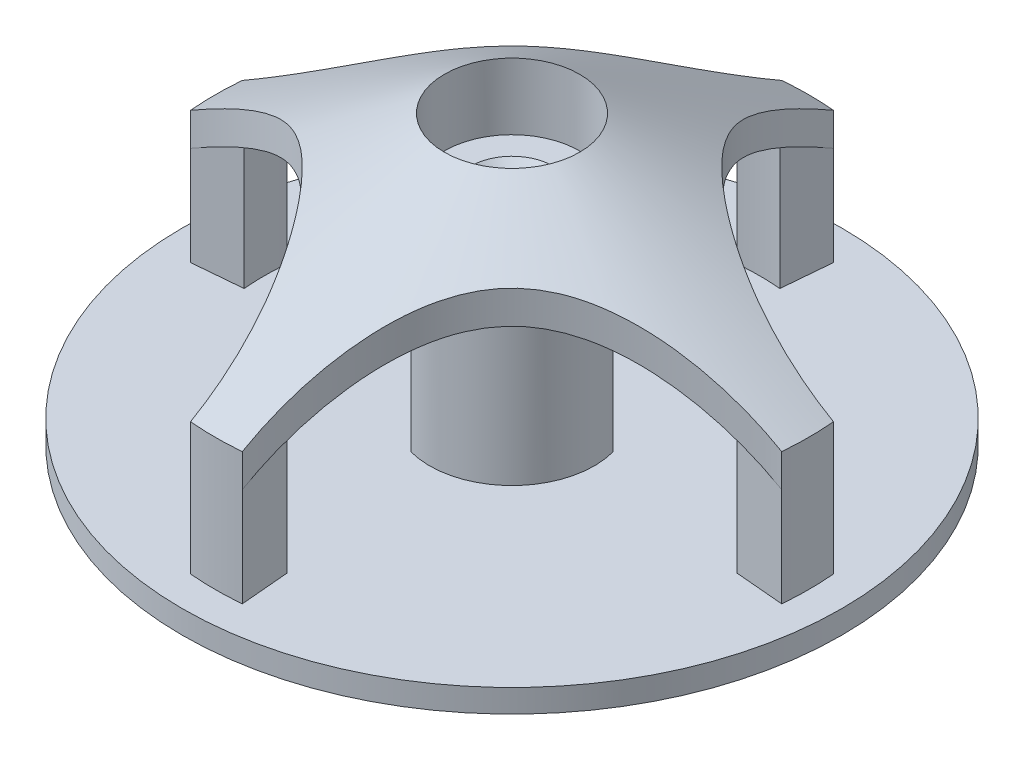
from build123d import *

# Parameters (mm, degrees)
SKETCH1_R                      = 127
BASE_OF_BASE_DEPTH             = 8.89
BALL_BEARING_CUT_REACH         = 221.212
SKETCH8_R                      = 26.035
SUPPORT_REACH                  = 208.429
SUPPORTS_COUNT                 = 4
CUT_FOR_PRINTABIITY_REACH      = 221.212
HOLDER_START                   = 76.2
SKETCH14_R                     = 26.035
SKETCH14_R_2                   = 13.335
HOLDER_FOR_SHOULDER_DEPTH      = 76.2
CENTER_CYLINDER_REACH          = 208.429
SKETCH14_3_R                   = 31.75
SKETCH14_3_R_2                 = 26.035
FUNNEL_INTO_SNAP_IN_PLACE_SIZE = 2.54
ACCESSIBILITY_CUT_DEPTH        = 290.1712073


with BuildPart() as part:
    # Sketch1 → Base of base (new body)
    with BuildSketch(Plane(origin=(0, 0, 0), x_dir=(1, 0, 0), z_dir=(0, 1, 0))):
        with Locations(Location((0, 0, 0), (0, 0, 270))):
            Circle(SKETCH1_R)
    extrude(amount=BASE_OF_BASE_DEPTH)



with BuildPart() as body_2:
    # Sketch7 → Top Part of Base (revolve)
    with BuildSketch(Plane(origin=(0, 0, 0), x_dir=(0, 0, -1), z_dir=(1, 0, 0)), mode=Mode.PRIVATE) as top_part_of_base_sk:
        Polygon((0, 125.681135768), (0, 112.981135768), (-114.3, 46.99), (-114.3, 59.69), align=None)
    revolve(top_part_of_base_sk.sketch.rotate(Axis((0, 8.89, 0), (0, 1, 0)), 180), axis=Axis((0, 8.89, 0), (0, 1, 0)))

    # Ball Bearing Cut: up to this cone (the profile starts outside it)
    ball_bearing_cut_end = Plane(origin=(0, 125.681136, 0), z_dir=(0, -1, 0)).offset(12.700001232) * Cone(1.732e-06, 362.01940299, 209.011998768, align=(Align.CENTER, Align.CENTER, Align.MIN), mode=Mode.PRIVATE)
    # Sketch8 → Ball Bearing Cut (cut, up to the surface)
    with BuildSketch(Plane(origin=(0, 125.681135768, 0), x_dir=(1, 0, 0), z_dir=(0, 1, 0)), mode=Mode.PRIVATE) as ball_bearing_cut_sk1:
        with Locations(Location((0, 0, 0), (0, 0, 90))):
            Circle(SKETCH8_R)
    ball_bearing_cut_tool1 = extrude(ball_bearing_cut_sk1.sketch, amount=-BALL_BEARING_CUT_REACH, mode=Mode.PRIVATE) - ball_bearing_cut_end
    add(ball_bearing_cut_tool1.solids().sort_by_distance((0, 125.681136, 0))[0], mode=Mode.SUBTRACT)


with BuildPart() as part_1:
    add(part.part)

    add(body_2.part)  # Support merges body 2
    # Support: up to this cone (the profile starts inside it)
    support_end = Plane(origin=(0, 8.89, 0), z_dir=(0, -1, 0)).offset(-104.091134768) * Cone(1.732e-06, 854.440186248, 493.311270537, align=(Align.CENTER, Align.CENTER, Align.MIN), mode=Mode.PRIVATE)
    # Sketch10 → Support (add, up to the surface)
    with BuildSketch(Plane(origin=(0, 8.89, 0), x_dir=(1, 0, 0), z_dir=(0, 1, 0)), mode=Mode.PRIVATE) as support_sk1:
        with BuildLine():
            ThreePointArc((-8.301584497, 94.887544993), (-4.154746647, 95.159343106), (0, 95.25))
            Line((0, 95.25), (0, 114.3))
            ThreePointArc((0, 114.3), (-4.985695976, 114.191211727), (-9.961901396, 113.865053992))
            Line((-9.961901396, 113.865053992), (-8.301584497, 94.887544993))
        make_face()
    support_tool1 = extrude(support_sk1.sketch, amount=SUPPORT_REACH, mode=Mode.PRIVATE) & support_end
    # Sketch10 → Support (add, up to the surface)
    with BuildSketch(Plane(origin=(0, 8.89, 0), x_dir=(1, 0, 0), z_dir=(0, 1, 0)), mode=Mode.PRIVATE) as support_sk2:
        with BuildLine():
            Line((0, 114.3), (0, 95.25))
            ThreePointArc((0, 95.25), (4.154746647, 95.159343106), (8.301584497, 94.887544993))
            Line((8.301584497, 94.887544993), (9.961901396, 113.865053992))
            ThreePointArc((9.961901396, 113.865053992), (4.985695976, 114.191211727), (0, 114.3))
        make_face()
    support_tool2 = extrude(support_sk2.sketch, amount=SUPPORT_REACH, mode=Mode.PRIVATE) & support_end
    support = support_tool1.solids().sort_by_distance((-4.581357, 8.89, -104.930336))[0] + support_tool2.solids().sort_by_distance((4.581357, 8.89, -104.930336))[0]
    add(support)

    # Supports: Support ×4 about axis
    supports_axis = Axis((0, 8.89, 0), (0, 1, 0))
    for i in range(1, SUPPORTS_COUNT):
        add(support.rotate(supports_axis, i * 360 / SUPPORTS_COUNT))

    # Cut for Printabiity: up to this cone (the profile starts outside it)
    cut_for_printabiity_end = Plane(origin=(0, 125.681136, 0), z_dir=(0, -1, 0)).offset(12.700001232) * Cone(1.732e-06, 362.01940299, 209.011998768, align=(Align.CENTER, Align.CENTER, Align.MIN), mode=Mode.PRIVATE)
    # Sketch12 → Cut for Printabiity (cut, up to the surface)
    with BuildSketch(Plane(origin=(0, 125.681135768, 0), x_dir=(1, 0, 0), z_dir=(0, 1, 0)), mode=Mode.PRIVATE) as cut_for_printabiity_sk1:
        with BuildLine():
            ThreePointArc((-113.865053992, -9.961901396), (-40.394430205, -40.394430205), (-9.961901396, -113.865053992))
            ThreePointArc((-9.961901396, -113.865053992), (-80.82230509, -80.82230509), (-113.865053992, -9.961901396))
        make_face()
    cut_for_printabiity_tool1 = extrude(cut_for_printabiity_sk1.sketch, amount=-CUT_FOR_PRINTABIITY_REACH, mode=Mode.PRIVATE) - cut_for_printabiity_end
    add(cut_for_printabiity_tool1.solids().sort_by_distance((-60.814886, 125.681136, 60.814886))[0], mode=Mode.SUBTRACT)
    # Sketch12 → Cut for Printabiity (cut, up to the surface)
    with BuildSketch(Plane(origin=(0, 125.681135768, 0), x_dir=(1, 0, 0), z_dir=(0, 1, 0)), mode=Mode.PRIVATE) as cut_for_printabiity_sk2:
        with BuildLine():
            ThreePointArc((-9.961901396, 113.865053992), (-40.394430205, 40.394430205), (-113.865053992, 9.961901396))
            ThreePointArc((-113.865053992, 9.961901396), (-80.82230509, 80.82230509), (-9.961901396, 113.865053992))
        make_face()
    cut_for_printabiity_tool2 = extrude(cut_for_printabiity_sk2.sketch, amount=-CUT_FOR_PRINTABIITY_REACH, mode=Mode.PRIVATE) - cut_for_printabiity_end
    add(cut_for_printabiity_tool2.solids().sort_by_distance((-60.814886, 125.681136, -60.814886))[0], mode=Mode.SUBTRACT)
    # Sketch12 → Cut for Printabiity (cut, up to the surface)
    with BuildSketch(Plane(origin=(0, 125.681135768, 0), x_dir=(1, 0, 0), z_dir=(0, 1, 0)), mode=Mode.PRIVATE) as cut_for_printabiity_sk3:
        with BuildLine():
            ThreePointArc((9.961901396, 113.865053992), (40.394430205, 40.394430205), (113.865053992, 9.961901396))
            ThreePointArc((113.865053992, 9.961901396), (80.82230509, 80.82230509), (9.961901396, 113.865053992))
        make_face()
    cut_for_printabiity_tool3 = extrude(cut_for_printabiity_sk3.sketch, amount=-CUT_FOR_PRINTABIITY_REACH, mode=Mode.PRIVATE) - cut_for_printabiity_end
    add(cut_for_printabiity_tool3.solids().sort_by_distance((60.814886, 125.681136, -60.814886))[0], mode=Mode.SUBTRACT)
    # Sketch12 → Cut for Printabiity (cut, up to the surface)
    with BuildSketch(Plane(origin=(0, 125.681135768, 0), x_dir=(1, 0, 0), z_dir=(0, 1, 0)), mode=Mode.PRIVATE) as cut_for_printabiity_sk4:
        with BuildLine():
            ThreePointArc((9.961901396, -113.865053992), (40.394430205, -40.394430205), (113.865053992, -9.961901396))
            ThreePointArc((113.865053992, -9.961901396), (80.82230509, -80.82230509), (9.961901396, -113.865053992))
        make_face()
    cut_for_printabiity_tool4 = extrude(cut_for_printabiity_sk4.sketch, amount=-CUT_FOR_PRINTABIITY_REACH, mode=Mode.PRIVATE) - cut_for_printabiity_end
    add(cut_for_printabiity_tool4.solids().sort_by_distance((60.814886, 125.681136, 60.814886))[0], mode=Mode.SUBTRACT)

    # Sketch14 → Holder for Shoulder (add)
    with BuildSketch(Plane(origin=(0, 8.89, 0), x_dir=(1, 0, 0), z_dir=(0, 1, 0)).offset(HOLDER_START)):
        with Locations(Location((0, 0, 0), (0, 0, 90))):
            Circle(SKETCH14_R)
        with Locations(Location((0, 0, 0), (0, 0, 90))):
            Circle(SKETCH14_R_2, mode=Mode.SUBTRACT)
    extrude(amount=-HOLDER_FOR_SHOULDER_DEPTH)

    # Center Cylinder: up to this cone (the profile starts inside it)
    center_cylinder_end = Plane(origin=(0, 8.89, 0), z_dir=(0, -1, 0)).offset(-104.091134768) * Cone(1.732e-06, 854.440186248, 493.311270537, align=(Align.CENTER, Align.CENTER, Align.MIN), mode=Mode.PRIVATE)
    # Sketch14<3> → Center Cylinder (add, up to the surface)
    with BuildSketch(Plane(origin=(0, 8.89, 0), x_dir=(1, 0, 0), z_dir=(0, 1, 0)), mode=Mode.PRIVATE) as center_cylinder_sk1:
        with Locations(Location((0, 0, 0), (0, 0, 90))):
            Circle(SKETCH14_3_R)
        with Locations(Location((0, 0, 0), (0, 0, 270))):
            Circle(SKETCH14_3_R_2, mode=Mode.SUBTRACT)
    center_cylinder_tool1 = extrude(center_cylinder_sk1.sketch, amount=CENTER_CYLINDER_REACH, mode=Mode.PRIVATE) & center_cylinder_end
    add(center_cylinder_tool1.solids().sort_by_distance((0, 8.89, 30.851974))[0])

    # Funnel into Snap in Place
    funnel_into_snap_in_place_edges = [part_1.edges().sort_by_distance(p)[0] for p in [
        (0, 85.09, 13.335),
    ]]
    chamfer(funnel_into_snap_in_place_edges, length=FUNNEL_INTO_SNAP_IN_PLACE_SIZE)

    # Sketch19 → Accessibility Cut (cut, through all)
    with BuildSketch(Plane(origin=(-61.913477694, 0, 61.913477694), x_dir=(-0.7071067811865487, 0, -0.7071067811865465), z_dir=(0.7071067811865465, 0, -0.7071067811865487))):
        Polygon((0, 8.89), (15.875, 8.89), (15.875, 43.815), (0, 59.69), (-15.875, 43.815), (-15.875, 8.89), align=None)
    extrude(amount=ACCESSIBILITY_CUT_DEPTH, mode=Mode.SUBTRACT)

    # Sketch20 → Cut-Revolve1 (revolve, cut)
    with BuildSketch(Plane(origin=(0, 0, 0), x_dir=(0, 0, -1), z_dir=(1, 0, 0))):
        Polygon((13.335, 74.295), (13.335, 79.375), (15.875, 79.375), align=None)
    revolve(axis=Axis((0, 8.89, 0), (0, 1, 0)), mode=Mode.SUBTRACT)


solid = part_1.part
